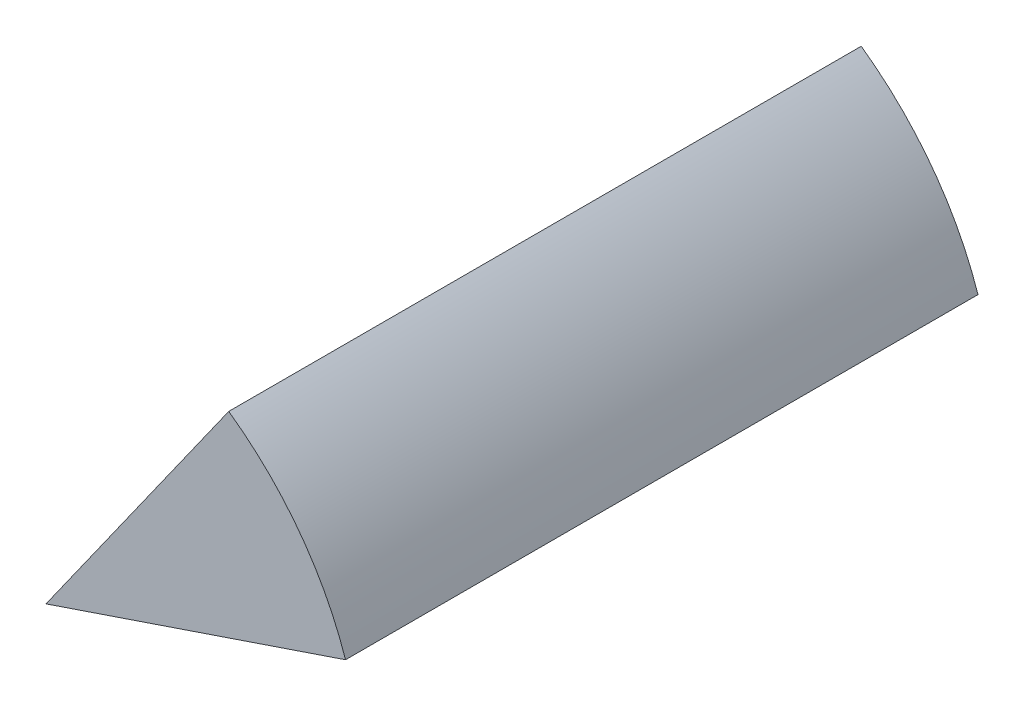
from build123d import *

# Parameters (mm, degrees)
SALIENTE_EXTRUIR1_DEPTH = 50
CROQUIS2_R              = 4.98750192
CORTAR_EXTRUIR1_DEPTH   = 10


with BuildPart() as part:
    # Croquis1 → Saliente-Extruir1 (new body)
    with BuildSketch(Plane.XY):
        with BuildLine():
            Line((0, 0), (14.447895207, 20.402409762))
            ThreePointArc((14.447895207, 20.402409762), (20.045456226, 14.9391996), (23.680828325, 8.013636494))
            Line((23.680828325, 8.013636494), (0, 0))
        make_face()
    extrude(amount=SALIENTE_EXTRUIR1_DEPTH)

    # Croquis2 → Cortar-Extruir1 (cut)
    with BuildSketch(Plane(origin=(0, 0, 0), x_dir=(-1, 0, 0), z_dir=(0, 0, -1))):
        with Locations((-14.944895644, 11.334340622)):
            Circle(CROQUIS2_R)
    extrude(amount=-CORTAR_EXTRUIR1_DEPTH, mode=Mode.SUBTRACT)


solid = part.part
